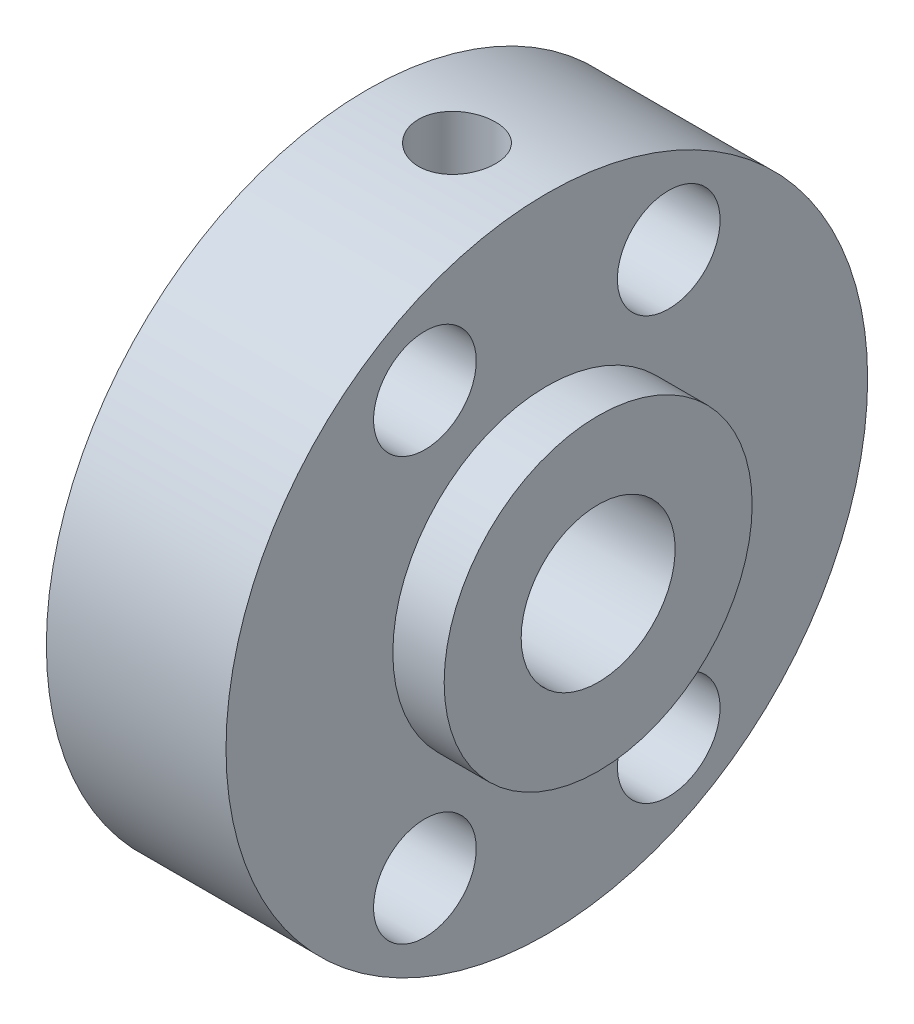
from build123d import *

# Parameters (mm, degrees)
ESQUISSE2_R             = 2
ENL_V_MAT_EXTRU_1_DEPTH = 20.013153342
ESQUISSE3_R             = 1.5
ENL_V_MAT_EXTRU_2_DEPTH = 30


with BuildPart() as part:
    # Esquisse1 → Révolution1 (revolve)
    with BuildSketch(Plane.XY, mode=Mode.PRIVATE) as r_volution1_sk:
        Polygon((0, 3), (0, 12.5), (7, 12.5), (7, 6), (9, 6), (9, 3), align=None)
    revolve(r_volution1_sk.sketch.rotate(Axis((0, 0, 0), (1, 0, 0)), 90), axis=Axis((0, 0, 0), (1, 0, 0)))

    # Esquisse2 → Enlèv. mat.-Extru.1 (cut, through all)
    with BuildSketch(Plane(origin=(7, 0, 0), x_dir=(0, 0, -1), z_dir=(1, 0, 0))):
        with Locations((-4.75, 8.227241336)):
            Circle(ESQUISSE2_R)
        with Locations((4.75, 8.227241336)):
            Circle(ESQUISSE2_R)
        with Locations((-4.75, -8.227241336)):
            Circle(ESQUISSE2_R)
        with Locations((4.75, -8.227241336)):
            Circle(ESQUISSE2_R)
    extrude(amount=-ENL_V_MAT_EXTRU_1_DEPTH, mode=Mode.SUBTRACT)

    # Esquisse3 → Enlèv. mat.-Extru.2 (cut)
    with BuildSketch(Plane(origin=(0, 0, 0), x_dir=(1, 0, 0), z_dir=(0, 1, 0))):
        with Locations(Location((3.5, 0, 0), (0, 0, 90))):
            Circle(ESQUISSE3_R)
    extrude(amount=ENL_V_MAT_EXTRU_2_DEPTH, mode=Mode.SUBTRACT)


solid = part.part
